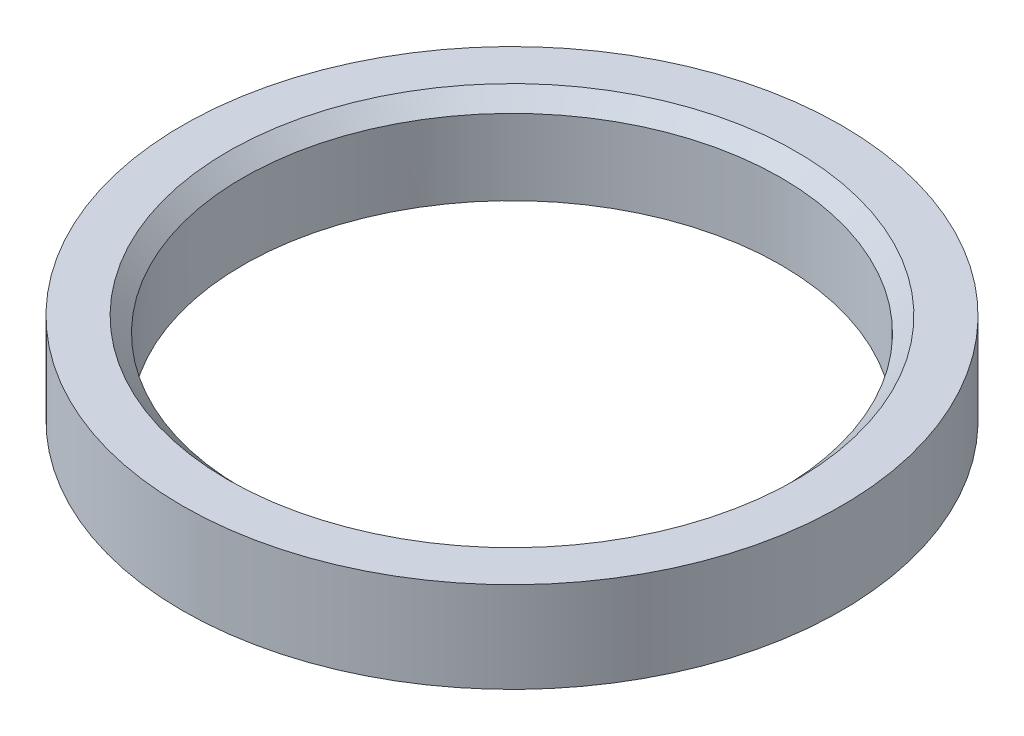
from build123d import *

# Parameters (mm, degrees)
SKETCH1_W     = 2
SKETCH1_H     = 3
CHAMFER1_SIZE = 0.5


with BuildPart() as part:
    # Sketch1 → Revolve1 (revolve)
    with BuildSketch(Plane.XY, mode=Mode.PRIVATE) as revolve1_sk:
        with Locations((9.9, 1.5)):
            Rectangle(SKETCH1_W, SKETCH1_H)
    revolve(revolve1_sk.sketch.rotate(Axis((0, 0, 0), (0, 1, 0)), 90), axis=Axis((0, 0, 0), (0, 1, 0)))

    # Chamfer1
    chamfer1_edges = [part.edges().sort_by_distance(p)[0] for p in [
        (0, 3, 8.9),
    ]]
    chamfer(chamfer1_edges, length=CHAMFER1_SIZE)


solid = part.part
